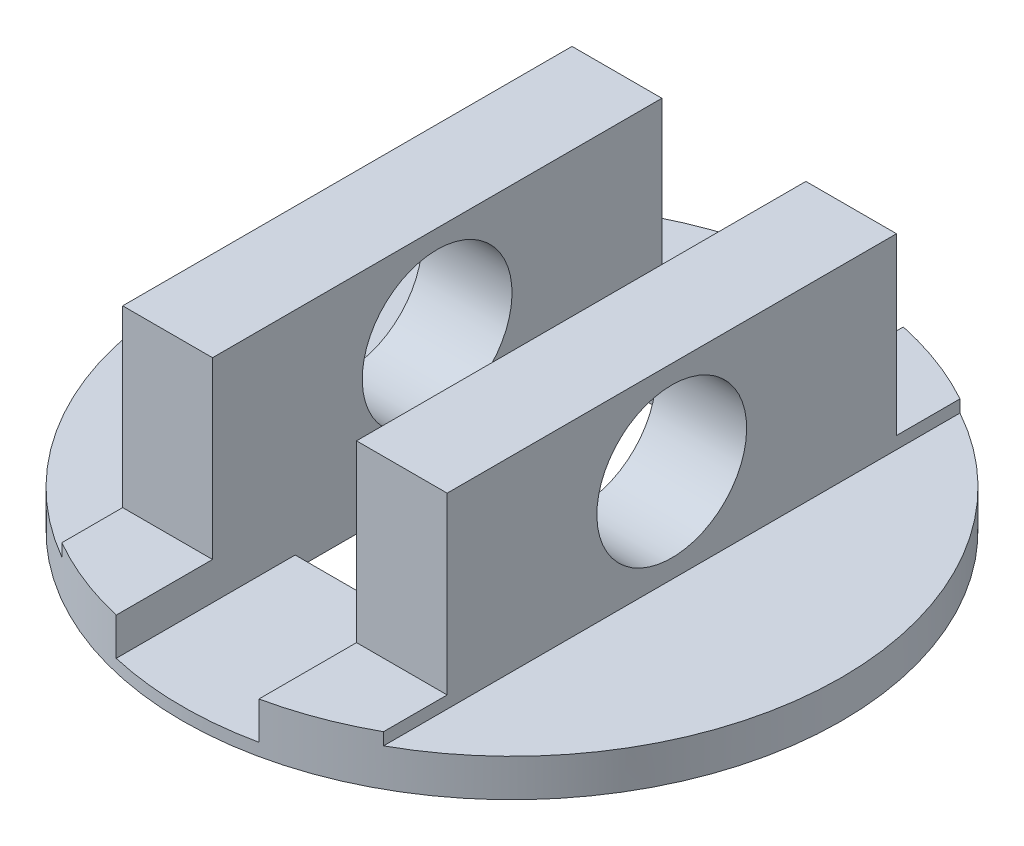
from build123d import *

# Parameters (mm, degrees)
SKETCH2_R           = 132
BOSS_EXTRUDE1_DEPTH = 90
SKETCH3_W           = 57.679416137
SKETCH3_H           = 85
CUT_EXTRUDE1_DEPTH  = 160
SKETCH4_W           = 66
SKETCH4_H           = 75
SKETCH4_W_2         = 69.873766725
SKETCH4_H_2         = 74.92536342
CUT_EXTRUDE2_DEPTH  = 160
SKETCH5_R           = 30
CUT_EXTRUDE3_DEPTH  = 160
SKETCH6_W           = 57.679416137
SKETCH6_H           = 128.655011674
CUT_EXTRUDE4_DEPTH  = 160
SKETCH7_W           = 202.247474543
SKETCH7_H           = 277.255171559
SKETCH7_W_2         = 143.334546523
SKETCH7_H_2         = 180
CUT_EXTRUDE5_DEPTH  = 70


with BuildPart() as part:
    # Sketch2 → Boss-Extrude1 (new body)
    with BuildSketch(Plane(origin=(0, 0, 0), x_dir=(1, 0, 0), z_dir=(0, 1, 0))):
        with Locations(Location((0, 0, 0), (0, 0, 90))):
            Circle(SKETCH2_R)
    extrude(amount=BOSS_EXTRUDE1_DEPTH)

    # Sketch3 → Cut-Extrude1 (cut, symmetric)
    with BuildSketch(Plane.XY):
        with Locations((-1.160291932, 47.5)):
            Rectangle(SKETCH3_W, SKETCH3_H)
    extrude(amount=CUT_EXTRUDE1_DEPTH, both=True, mode=Mode.SUBTRACT)

    # Sketch4 → Cut-Extrude2 (cut, symmetric)
    with BuildSketch(Plane.XY):
        with Locations((-99, 52.5)):
            Rectangle(SKETCH4_W, SKETCH4_H)
        with Locations((98.918931808, 52.53731829)):
            Rectangle(SKETCH4_W_2, SKETCH4_H_2)
    extrude(amount=CUT_EXTRUDE2_DEPTH, both=True, mode=Mode.SUBTRACT)

    # Sketch5 → Cut-Extrude3 (cut, symmetric)
    with BuildSketch(Plane(origin=(63.982048445, 0, 0), x_dir=(0, 0, -1), z_dir=(1, 0, 0))):
        with Locations(Location((0, 52.53731829, 0), (0, 0, 90))):
            Circle(SKETCH5_R)
    extrude(amount=CUT_EXTRUDE3_DEPTH, both=True, mode=Mode.SUBTRACT)

    # Sketch6 → Cut-Extrude4 (cut, symmetric)
    with BuildSketch(Plane(origin=(0, 5, 0), x_dir=(1, 0, 0), z_dir=(0, 1, 0))):
        with Locations((-1.160291932, 7.462587684)):
            Rectangle(SKETCH6_W, SKETCH6_H)
    extrude(amount=CUT_EXTRUDE4_DEPTH, both=True, mode=Mode.SUBTRACT)

    # Sketch7 → Cut-Extrude5 (cut, symmetric)
    with BuildSketch(Plane(origin=(0, 90, 0), x_dir=(1, 0, 0), z_dir=(0, 1, 0))):
        with Locations((-4.464336864, -2.73307398)):
            Rectangle(SKETCH7_W, SKETCH7_H)
        with Locations((-1.427587997, 0.039603907)):
            Rectangle(SKETCH7_W_2, SKETCH7_H_2, mode=Mode.SUBTRACT)
    extrude(amount=CUT_EXTRUDE5_DEPTH, both=True, mode=Mode.SUBTRACT)


solid = part.part
